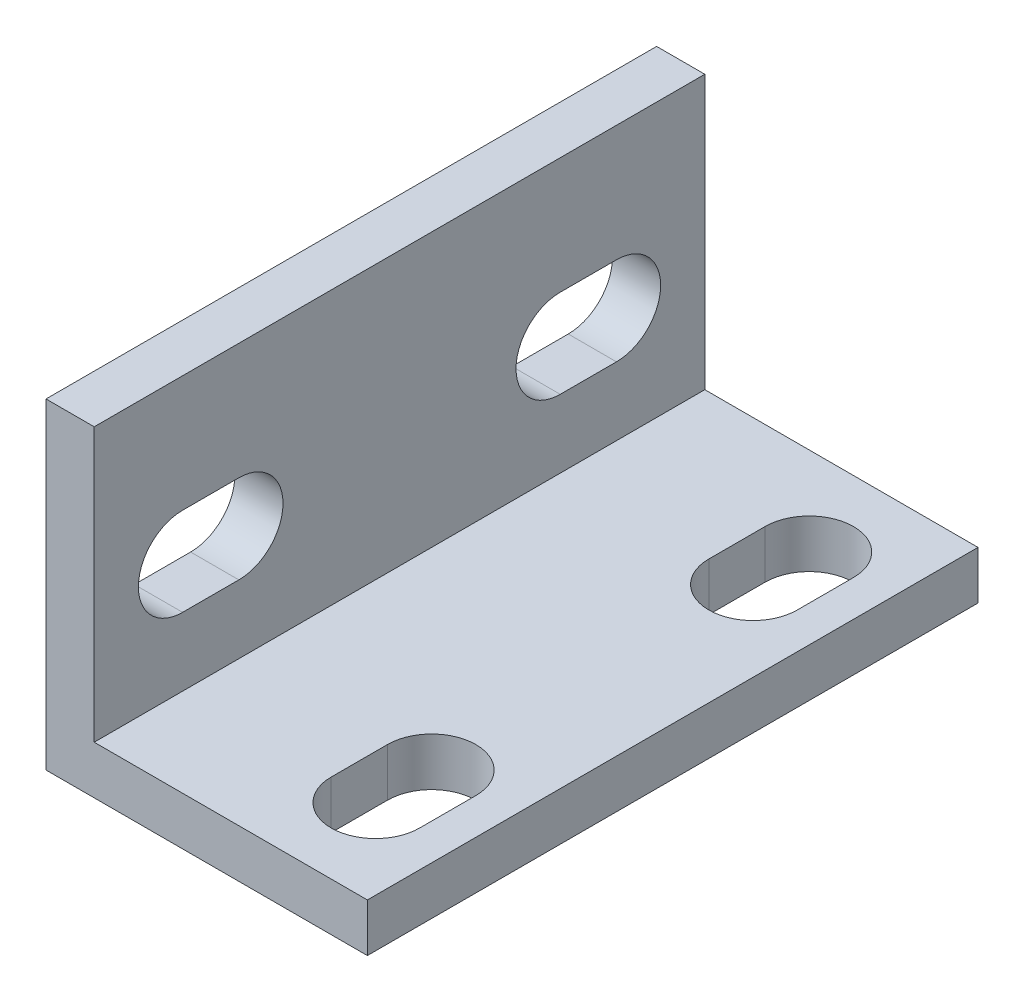
from build123d import *

# Parameters (mm, degrees)
EXTRUDE_THIN1_DEPTH = 38
CUT_EXTRUDE1_DEPTH  = 47.184412955
CUT_EXTRUDE2_DEPTH  = 47.184412955


with BuildPart() as part:
    # Sketch1 → Extrude-Thin1 (new body)
    with BuildSketch(Plane.XY):
        Polygon((0, 20), (0, 0), (20, 0), (20, 3), (3, 3), (3, 20), align=None)
    extrude(amount=EXTRUDE_THIN1_DEPTH)

    # Sketch2 → Cut-Extrude1 (cut, through all)
    with BuildSketch(Plane(origin=(3, 0, 0), x_dir=(0, 0, -1), z_dir=(1, 0, 0))):
        with BuildLine():
            Line((-29, 7.25), (-32.5, 7.25))
            ThreePointArc((-32.5, 7.25), (-35.25, 10), (-32.5, 12.75))
            Line((-32.5, 12.75), (-29, 12.75))
            ThreePointArc((-29, 12.75), (-26.25, 10), (-29, 7.25))
        make_face()
        with BuildLine():
            Line((-9, 7.25), (-5.5, 7.25))
            ThreePointArc((-5.5, 7.25), (-2.75, 10), (-5.5, 12.75))
            Line((-5.5, 12.75), (-9, 12.75))
            ThreePointArc((-9, 12.75), (-11.75, 10), (-9, 7.25))
        make_face()
    extrude(amount=-CUT_EXTRUDE1_DEPTH, mode=Mode.SUBTRACT)

    # Sketch3 → Cut-Extrude2 (cut, through all)
    with BuildSketch(Plane(origin=(0, 3, 0), x_dir=(1, 0, 0), z_dir=(0, 1, 0))):
        with BuildLine():
            Line((12.25, -32.5), (12.25, -29))
            ThreePointArc((12.25, -29), (15, -26.25), (17.75, -29))
            Line((17.75, -29), (17.75, -32.5))
            ThreePointArc((17.75, -32.5), (15, -35.25), (12.25, -32.5))
        make_face()
        with BuildLine():
            Line((12.25, -5.5), (12.25, -9))
            ThreePointArc((12.25, -9), (15, -11.75), (17.75, -9))
            Line((17.75, -9), (17.75, -5.5))
            ThreePointArc((17.75, -5.5), (15, -2.75), (12.25, -5.5))
        make_face()
    extrude(amount=-CUT_EXTRUDE2_DEPTH, mode=Mode.SUBTRACT)


solid = part.part
